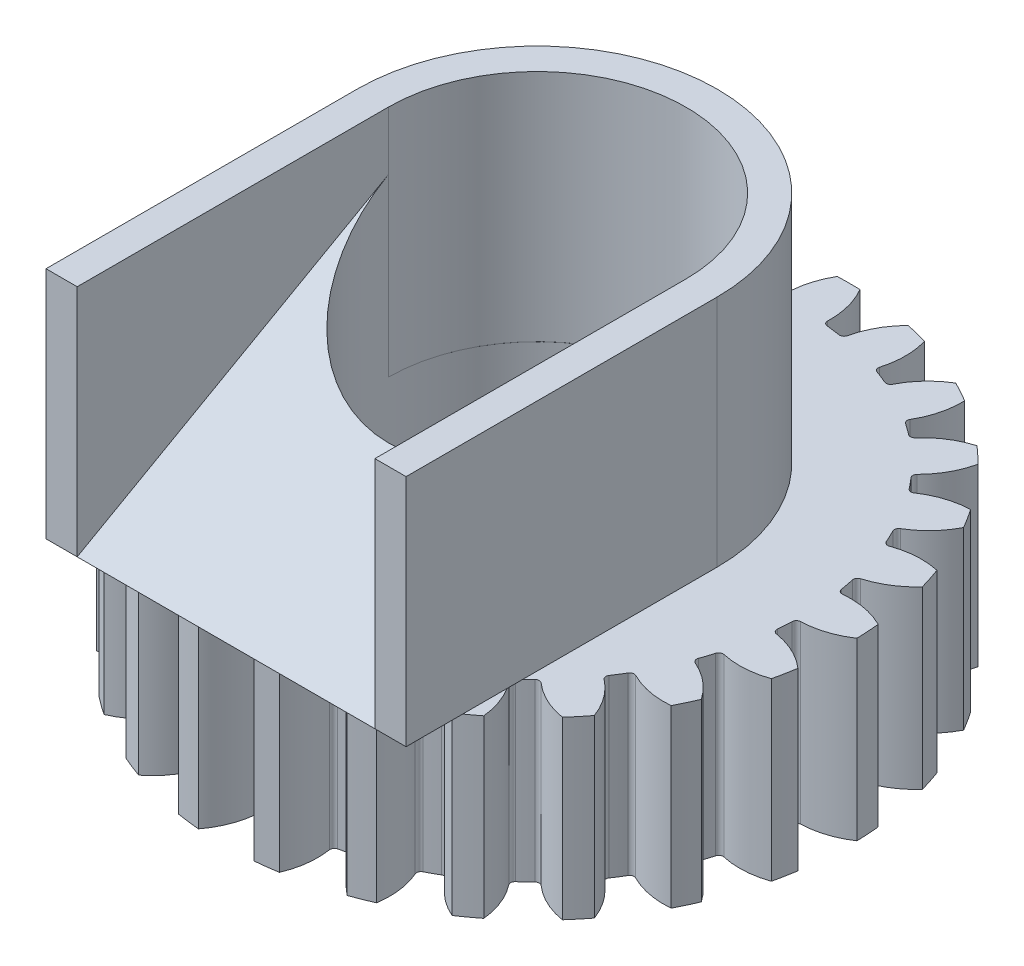
from build123d import *

# Parameters (mm, degrees)
SKETCH3_W                = 20.95
SKETCH3_H                = 22.5
CUT_EXTRUDE1_DEPTH       = 75.848129981
FILLET1_R                = 0.57
CIRPATTERN1_COUNT        = 25
FILLET1_OF_CIRPATTERN1_R = 0.57
BOSS_EXTRUDE1_DEPTH      = 30
BOSS_EXTRUDE2_DEPTH      = 39
SKETCH9_R                = 19.05
CUT_EXTRUDE2_DEPTH       = 78.423121144


with BuildPart() as part:
    # Sketch3 → Revolve1 (revolve)
    with BuildSketch(Plane.XY, mode=Mode.PRIVATE) as revolve1_sk:
        with Locations((10.398080905, 14.564536648)):
            Rectangle(SKETCH3_W, SKETCH3_H)
    revolve(revolve1_sk.sketch.rotate(Axis((-19.126919095, 24.943438473, 0), (0, -1, 0)), 90), axis=Axis((-19.126919095, 24.943438473, 0), (0, -1, 0)))

    # Sketch5 → Cut-Extrude1 (cut, through all)
    with BuildSketch(Plane.XZ.offset(-3.314536648)):
        with BuildLine():
            ThreePointArc((-15.560842547, 39.840721606), (-19.126919095, 40), (-22.692995643, 39.840721606))
            ThreePointArc((-22.692995643, 39.840721606), (-21.170423487, 37.070640404), (-20.556207552, 33.969944576))
            ThreePointArc((-20.556207552, 33.969944576), (-19.126919095, 34), (-17.697630638, 33.969944576))
            ThreePointArc((-17.697630638, 33.969944576), (-17.083414703, 37.070640404), (-15.560842547, 39.840721606))
        make_face()
    cut_extrude1 = extrude(amount=-CUT_EXTRUDE1_DEPTH, mode=Mode.SUBTRACT)

    # Fillet1
    fillet1_edges = [part.edges().sort_by_distance(p)[0] for p in [
        (-20.556207552, 14.564536648, 33.969944576),
        (-17.697630638, 14.564536648, 33.969944576),
    ]]
    fillet(fillet1_edges, radius=FILLET1_R)

    # CirPattern1: Cut-Extrude1 ×25 about axis
    cirpattern1_axis = Axis((-19.126919095, 0, 0), (0, 1, 0))
    for i in range(1, CIRPATTERN1_COUNT):
        add(cut_extrude1.rotate(cirpattern1_axis, i * 360 / CIRPATTERN1_COUNT), mode=Mode.SUBTRACT)

    # Fillet1 of CirPattern1
    fillet1_of_cirpattern1_edges = [part.edges().sort_by_distance(p)[0] for p in [
        (-12.063322143, 14.564536648, 33.258165886),
        (-9.294552679, 14.564536648, 32.547266716),
        (-4.014268509, 14.564536648, 30.456654318),
        (-1.509278464, 14.564536648, 29.079524387),
        (3.085201708, 14.564536648, 25.741439148),
        (5.169014598, 14.564536648, 23.784608594),
        (8.789002685, 14.564536648, 19.408794686),
        (10.320704792, 14.564536648, 16.99521837),
        (12.738743629, 14.564536648, 11.856624273),
        (13.622092476, 14.564536648, 9.137956071),
        (14.68624779, 14.564536648, 3.559458551),
        (14.86573932, 14.564536648, 0.706522385),
        (14.50914632, 14.564536648, -4.961361042),
        (13.97350242, 14.564536648, -7.7693047),
        (12.218567155, 14.564536648, -13.170440074),
        (11.001444302, 14.564536648, -15.756957798),
        (7.958435808, 14.564536648, -20.551971919),
        (6.136310306, 14.564536648, -22.754543287),
        (1.996432, 14.564536648, -26.642147784),
        (-0.316205304, 14.564536648, -28.322377137),
        (-5.292829644, 14.564536648, -31.05829952),
        (-7.950667242, 14.564536648, -32.110611868),
        (-13.451338006, 14.564536648, -33.522944073),
        (-16.287374188, 14.564536648, -33.881218761),
        (-21.966464002, 14.564536648, -33.881218761),
        (-24.802500184, 14.564536648, -33.522944073),
        (-30.303170948, 14.564536648, -32.110611868),
        (-32.961008546, 14.564536648, -31.05829952),
        (-37.937632886, 14.564536648, -28.322377137),
        (-40.25027019, 14.564536648, -26.642147784),
        (-44.390148496, 14.564536648, -22.754543287),
        (-46.212273998, 14.564536648, -20.551971919),
        (-49.255282491, 14.564536648, -15.756957798),
        (-50.472405345, 14.564536648, -13.170440074),
        (-52.22734061, 14.564536648, -7.7693047),
        (-52.76298451, 14.564536648, -4.961361042),
        (-53.11957751, 14.564536648, 0.706522385),
        (-52.94008598, 14.564536648, 3.559458551),
        (-51.875930665, 14.564536648, 9.137956071),
        (-50.992581819, 14.564536648, 11.856624273),
        (-48.574542982, 14.564536648, 16.99521837),
        (-47.042840875, 14.564536648, 19.408794686),
        (-43.422852788, 14.564536648, 23.784608594),
        (-41.339039898, 14.564536648, 25.741439148),
        (-36.744559726, 14.564536648, 29.079524387),
        (-34.239569681, 14.564536648, 30.456654318),
        (-28.959285511, 14.564536648, 32.547266716),
        (-26.190516046, 14.564536648, 33.258165886),
    ]]
    fillet(fillet1_of_cirpattern1_edges, radius=FILLET1_OF_CIRPATTERN1_R)

    # Sketch6 → Boss-Extrude1 (add)
    with BuildSketch(Plane(origin=(0, 25.814536648, 0), x_dir=(1, 0, 0), z_dir=(0, 1, 0))):
        with BuildLine():
            Line((-42.176919095, 0), (-42.176919095, -39.901687621))
            Line((-42.176919095, -39.901687621), (-38.176919095, -39.901687621))
            Line((-38.176919095, -39.901687621), (-38.176919095, 0))
            ThreePointArc((-38.176919095, 0), (-19.088459547, 19.088459547), (0, 0))
            Line((0, 0), (0, -39.901687621))
            Line((0, -39.901687621), (4, -39.901687621))
            Line((4, -39.901687621), (4, 0))
            ThreePointArc((4, 0), (-19.088459547, 23.088459547), (-42.176919095, 0))
        make_face()
    extrude(amount=BOSS_EXTRUDE1_DEPTH)

    # Sketch8 → Boss-Extrude2 (add)
    with BuildSketch(Plane(origin=(-38.176919095, 0, 0), x_dir=(0, 0, -1), z_dir=(1, 0, 0))):
        Polygon((0, 25.814536648), (-39.901687621, 25.814536648), (0, 48.314536648), align=None)
    extrude(amount=BOSS_EXTRUDE2_DEPTH)

    # Sketch9 → Cut-Extrude2 (cut, through all)
    with BuildSketch(Plane(origin=(0, 25.814536648, 0), x_dir=(-1, 0, 0), z_dir=(0, -1, 0))):
        with Locations(Location((19.126919095, 0, 0), (0, 0, 270))):
            Circle(SKETCH9_R)
    extrude(amount=-CUT_EXTRUDE2_DEPTH, mode=Mode.SUBTRACT)


solid = part.part
